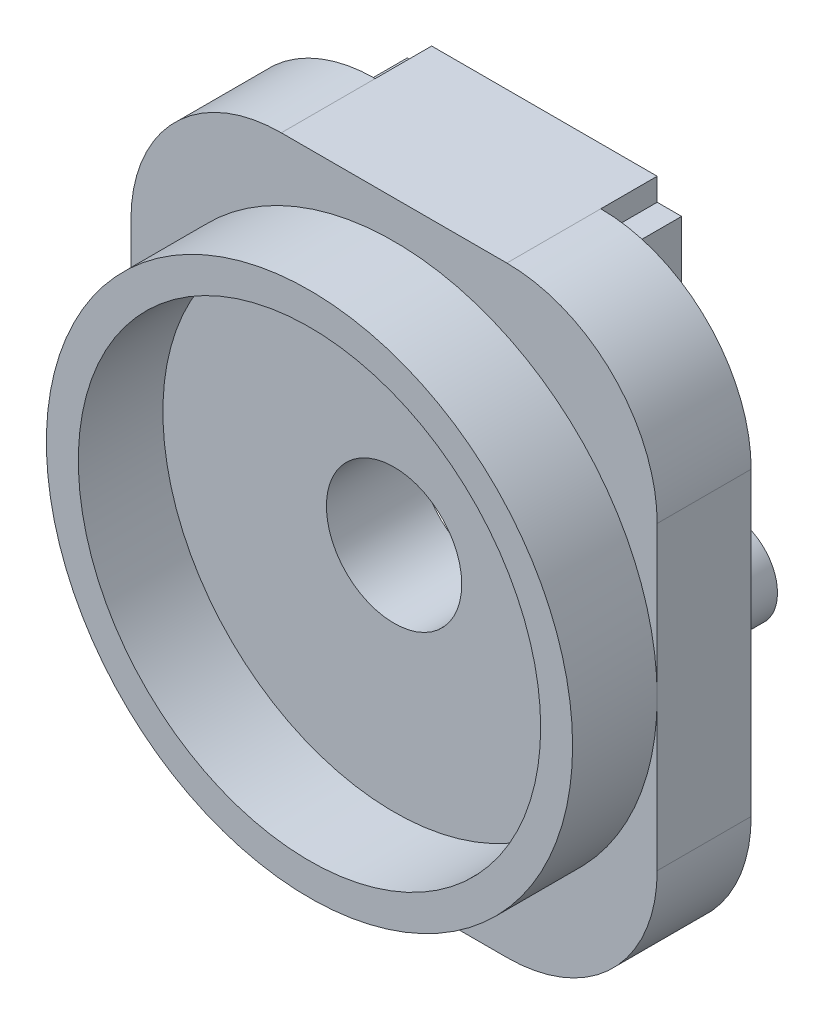
from build123d import *

# Parameters (mm, degrees)
EXTRUDE_1_DEPTH        = 5
SKETCH_2_R             = 14
SKETCH_2_R_2           = 12.3
EXTRUDE_2_DEPTH        = 4.5
SKETCH_3_W             = 14.3
SKETCH_3_H             = 14.3
EXTRUDE_3_DEPTH        = 3
SKETCH_4_R             = 3.6
CUT_EXTRUDE_2_DEPTH    = 24.286262044
HOLE_WIZARD_M2_1_D     = 2.4
HOLE_WIZARD_M2_1_DEPTH = 3
HOLE_WIZARD_M2_1_TIP   = 0.721032743


with BuildPart() as part:
    # 스케치1 → 보스-돌출1 (new body)
    with BuildSketch(Plane.XY):
        with BuildLine():
            Line((-6, 16), (6, 16))
            ThreePointArc((6, 16), (11.656854249, 13.656854249), (14, 8))
            Line((14, 8), (14, -8))
            ThreePointArc((14, -8), (11.656854249, -13.656854249), (6, -16))
            Line((6, -16), (-6, -16))
            ThreePointArc((-6, -16), (-11.656854249, -13.656854249), (-14, -8))
            Line((-14, -8), (-14, 8))
            ThreePointArc((-14, 8), (-11.656854249, 13.656854249), (-6, 16))
        make_face()
    extrude(amount=EXTRUDE_1_DEPTH)

    # 스케치2 → 보스-돌출2 (add)
    with BuildSketch(Plane.XY.offset(5)):
        Circle(SKETCH_2_R)
        Circle(SKETCH_2_R_2, mode=Mode.SUBTRACT)
    extrude(amount=EXTRUDE_2_DEPTH)

    # 스케치3 → 보스-돌출3 (add)
    with BuildSketch(Plane(origin=(0, 0, 0), x_dir=(-1, 0, 0), z_dir=(0, 0, -1))):
        with BuildLine():
            Line((-7.9, 7.9), (-3.3, 7.9))
            Line((-3.3, 7.9), (-3.3, 8.6))
            Line((-3.3, 8.6), (-6, 8.6))
            Line((-6, 8.6), (-6, 9.8))
            Line((-6, 9.8), (-7.3, 9.8))
            Line((-7.3, 9.8), (-7.3, 14.8))
            Line((-7.3, 14.8), (-6, 14.8))
            Line((-6, 14.8), (-6, 16))
            Line((-6, 16), (6, 16))
            Line((6, 16), (6, 14.8))
            Line((6, 14.8), (7.3, 14.8))
            Line((7.3, 14.8), (7.3, 9.8))
            Line((7.3, 9.8), (6, 9.8))
            Line((6, 9.8), (6, 8.6))
            Line((6, 8.6), (2.9, 8.6))
            Line((2.9, 8.6), (2.9, 7.9))
            Line((2.9, 7.9), (7.9, 7.9))
            Line((7.9, 7.9), (7.9, 2.4))
            Line((7.9, 2.4), (10, 2.4))
            ThreePointArc((10, 2.4), (12.4, 0), (10, -2.4))
            Line((10, -2.4), (7.9, -2.4))
            Line((7.9, -2.4), (7.9, -7.9))
            Line((7.9, -7.9), (-7.9, -7.9))
            Line((-7.9, -7.9), (-7.9, -2.4))
            Line((-7.9, -2.4), (-10, -2.4))
            ThreePointArc((-10, -2.4), (-12.4, 0), (-10, 2.4))
            Line((-10, 2.4), (-7.9, 2.4))
            Line((-7.9, 2.4), (-7.9, 7.9))
        make_face()
        Rectangle(SKETCH_3_W, SKETCH_3_H, mode=Mode.SUBTRACT)
    extrude(amount=EXTRUDE_3_DEPTH)

    # 스케치4 → 컷-돌출2 (cut, through all)
    with BuildSketch(Plane.XY):
        Circle(SKETCH_4_R)
    extrude(amount=CUT_EXTRUDE_2_DEPTH, mode=Mode.SUBTRACT)

    # M2 여유 구멍1
    with Locations(Plane(origin=(-10, 0, -3), x_dir=(-1, 0, 0), z_dir=(0, 0, -1))):
        with Locations((0, 0), (-20, 0)):
            Hole(HOLE_WIZARD_M2_1_D / 2, depth=HOLE_WIZARD_M2_1_DEPTH)
            with Locations((0, 0, -(HOLE_WIZARD_M2_1_DEPTH + HOLE_WIZARD_M2_1_TIP / 2))):  # 118° drill point
                Cone(0, HOLE_WIZARD_M2_1_D / 2, HOLE_WIZARD_M2_1_TIP, mode=Mode.SUBTRACT)


solid = part.part
